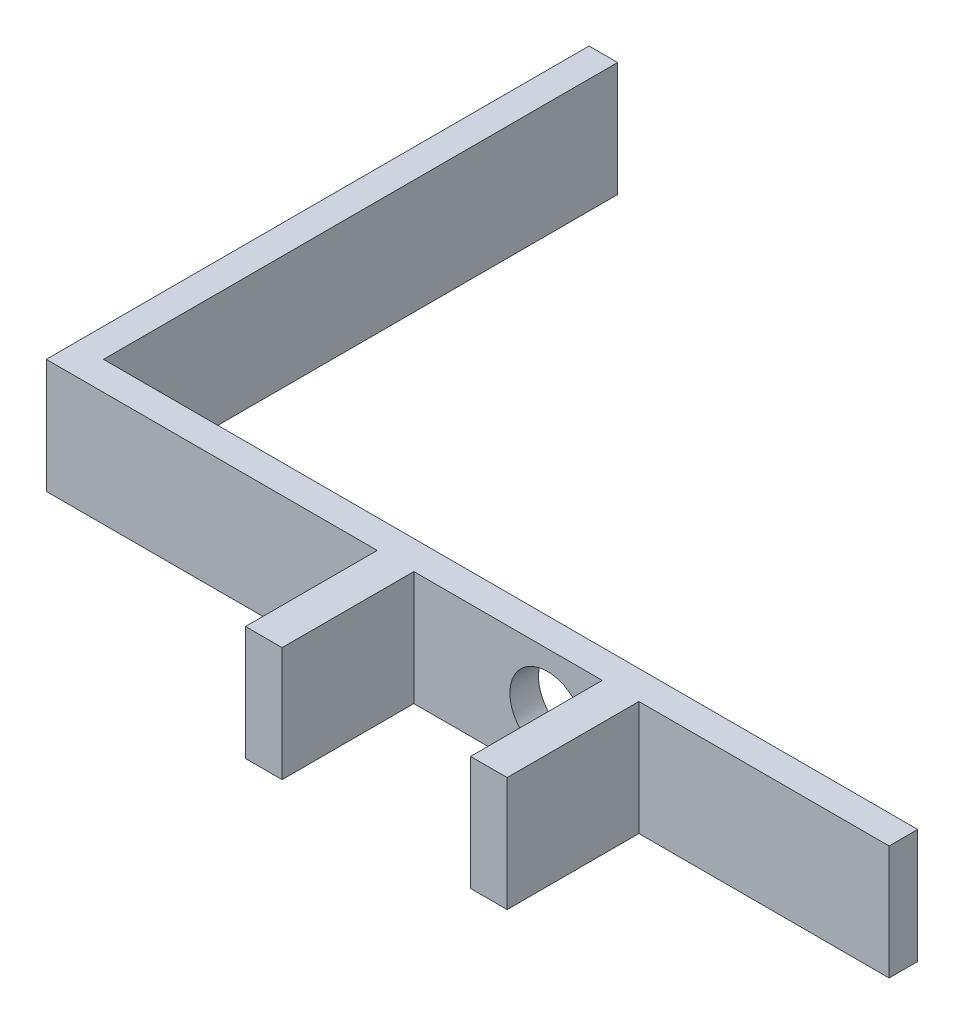
from build123d import *

# Parameters (mm, degrees)
BOSS_EXTRUDE1_DEPTH = 7.9375
SKETCH2_R           = 5.207
CUT_EXTRUDE1_DEPTH  = 3.96875
SKETCH4_W           = 5.08
SKETCH4_H           = 15.875
BOSS_EXTRUDE2_DEPTH = 18.288


with BuildPart() as part:
    # Sketch1 → Boss-Extrude1 (new, symmetric)
    with BuildSketch(Plane(origin=(0, 0, 0), x_dir=(1, 0, 0), z_dir=(0, 1, 0))):
        Polygon((0, 0), (3.96875, 0), (116.99875, 0), (116.99875, 3.96875), (3.96875, 3.96875), (3.96875, 75.34275), (0, 75.34275), align=None)
    extrude(amount=BOSS_EXTRUDE1_DEPTH, both=True)

    # Sketch2 → Cut-Extrude1 (cut)
    with BuildSketch(Plane.XY):
        with Locations((69.56425, 0)):
            Circle(SKETCH2_R)
    extrude(amount=-CUT_EXTRUDE1_DEPTH, mode=Mode.SUBTRACT)

    # Sketch4 → Boss-Extrude2 (add)
    with BuildSketch(Plane.XY):
        with Locations((48.48225, 0)):
            Rectangle(SKETCH4_W, SKETCH4_H)
        with Locations((79.72425, 0)):
            Rectangle(SKETCH4_W, SKETCH4_H)
    extrude(amount=BOSS_EXTRUDE2_DEPTH)


solid = part.part
